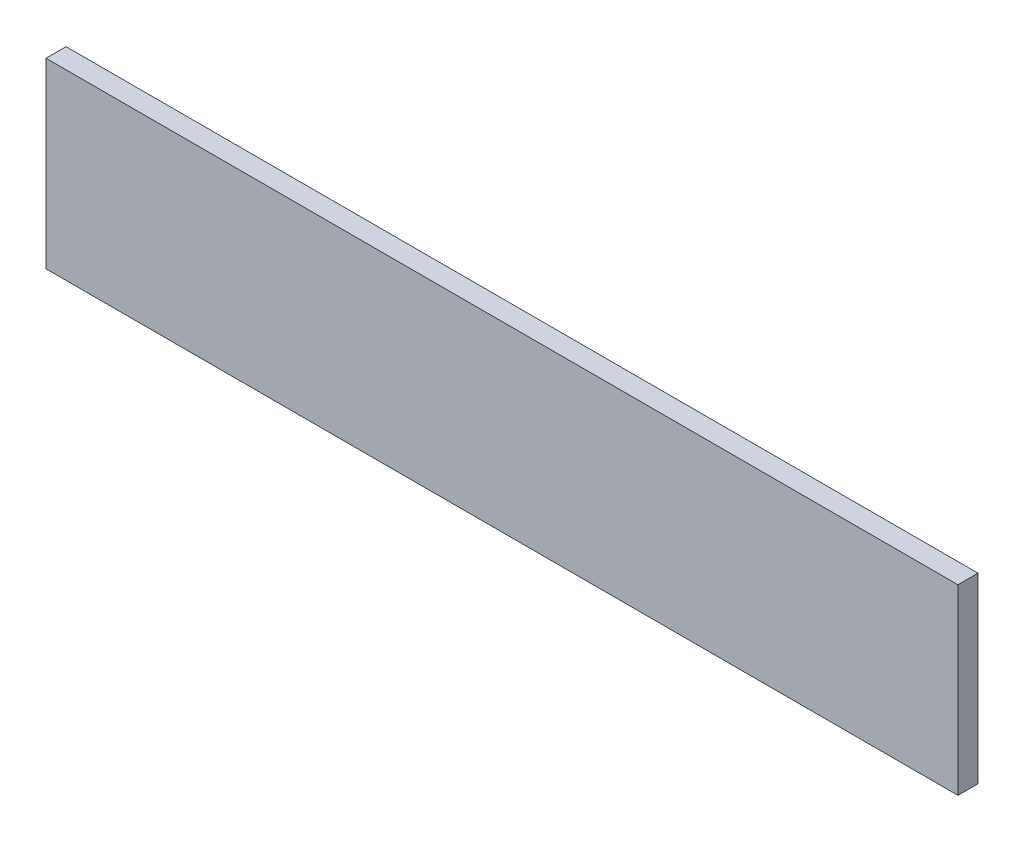
from build123d import *

# Parameters (mm, degrees)
SKETCH1_W        = 1000
SKETCH1_H        = 200
EXTRUSION1_DEPTH = 22


with BuildPart() as part:
    # Sketch1 → Extrusion1 (new body)
    with BuildSketch(Plane.XY):
        Rectangle(SKETCH1_W, SKETCH1_H)
    extrude(amount=EXTRUSION1_DEPTH)


solid = part.part
